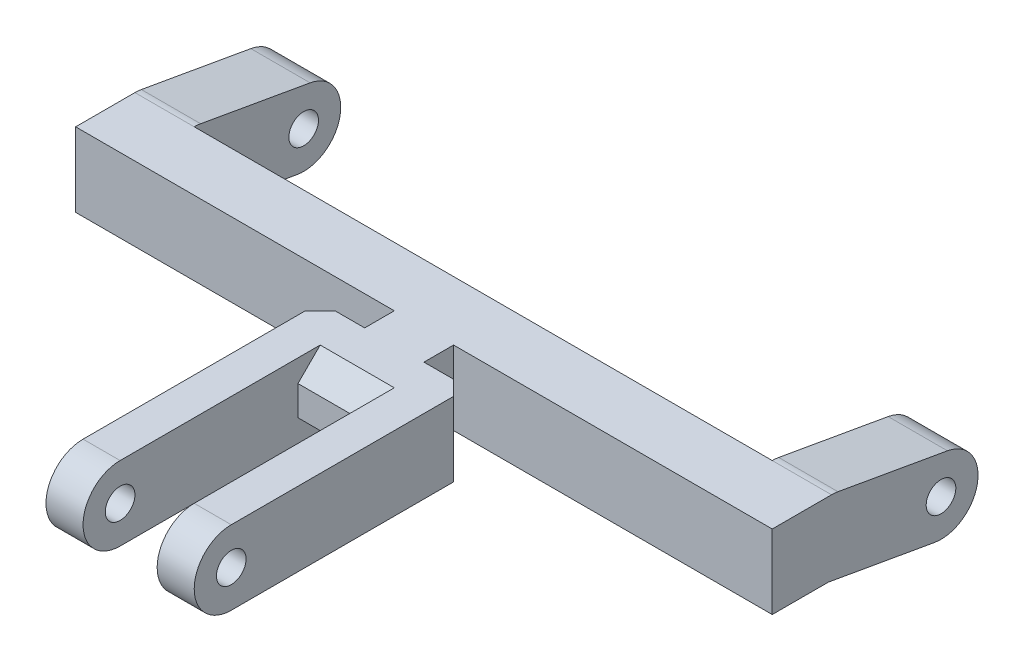
from build123d import *

# Parameters (mm, degrees)
EXTRUDE_1_DEPTH = 10
EXTRUDE_START   = 47
SKETCH_6_R      = 2
EXTRUDE_2_DEPTH = 8
EXTRUDE_START_2 = -39
SKETCH_6_2_R    = 2
EXTRUDE_3_DEPTH = 8
CHAMFER_2_SIZE  = 2
SKETCH_7_R      = 2
EXTRUDE_4_DEPTH = 5
CHAMFER_3_SIZE  = 3


with BuildPart() as part:
    # 草图1 → 凸台-拉伸1 (new body)
    with BuildSketch(Plane(origin=(0, 0, 0), x_dir=(1, 0, 0), z_dir=(0, 1, 0))):
        Polygon((-47, 0), (47, 0), (47, -8), (4, -8), (4, -12), (10, -12), (10, -20), (-10, -20), (-10, -12), (-4, -12), (-4, -8), (-47, -8), align=None)
    extrude(amount=EXTRUDE_1_DEPTH)

    # 草图6 → 凸台-拉伸2 (add)
    with BuildSketch(Plane(origin=(0, 0, 0), x_dir=(0, 0, -1), z_dir=(1, 0, 0)).offset(EXTRUDE_START)):
        with BuildLine():
            Line((0.868240888, 9.924038765), (15.640357184, 7.3193161))
            ThreePointArc((15.640357184, 7.3193161), (19.69615506, 1.527036447), (13.903875407, -2.52876143))
            Line((13.903875407, -2.52876143), (-0.868240888, 0.075961235))
            ThreePointArc((-0.868240888, 0.075961235), (-4.924038765, 5.868240888), (0.868240888, 9.924038765))
        make_face()
        with Locations(Location((14.772116295, 2.395277335, 0), (0, 0, 180))):
            Circle(SKETCH_6_R, mode=Mode.SUBTRACT)
    extrude(amount=-EXTRUDE_2_DEPTH)

    # 草图6<2> → 凸台-拉伸3 (add)
    with BuildSketch(Plane(origin=(0, 0, 0), x_dir=(0, 0, -1), z_dir=(1, 0, 0)).offset(EXTRUDE_START_2)):
        with BuildLine():
            Line((0.868240888, 9.924038765), (15.640357184, 7.3193161))
            ThreePointArc((15.640357184, 7.3193161), (19.69615506, 1.527036447), (13.903875407, -2.52876143))
            Line((13.903875407, -2.52876143), (-0.868240888, 0.075961235))
            ThreePointArc((-0.868240888, 0.075961235), (-4.924038765, 5.868240888), (0.868240888, 9.924038765))
        make_face()
        with Locations(Location((14.772116295, 2.395277335, 0), (0, 0, 180))):
            Circle(SKETCH_6_2_R, mode=Mode.SUBTRACT)
    extrude(amount=-EXTRUDE_3_DEPTH)

    # 倒角2
    chamfer_2_edges = [part.edges().sort_by_distance(p)[0] for p in [
        (10, 5, 12),
        (-10, 5, 12),
    ]]
    chamfer(chamfer_2_edges, length=CHAMFER_2_SIZE)

    # 草图7 → 凸台-拉伸4 (add)
    with BuildSketch(Plane.ZY.offset(10)):
        with BuildLine():
            Line((20, 10), (44, 10))
            ThreePointArc((44, 10), (49, 5), (44, 0))
            Line((44, 0), (20, 0))
            ThreePointArc((20, 0), (15, 5), (20, 10))
        make_face()
        with Locations((44, 5)):
            Circle(SKETCH_7_R, mode=Mode.SUBTRACT)
    extrude_4 = extrude(amount=-EXTRUDE_4_DEPTH)

    # 镜向1: 凸台-拉伸4 across plane
    add(extrude_4.mirror(Plane(origin=(0, 0, 0), x_dir=(0, 0, 1), z_dir=(1, 0, 0))))

    # 倒角3
    chamfer_3_edges = [part.edges().sort_by_distance(p)[0] for p in [
        (0, 0, 20),
        (0, 10, 20),
    ]]
    chamfer(chamfer_3_edges, length=CHAMFER_3_SIZE)


solid = part.part
